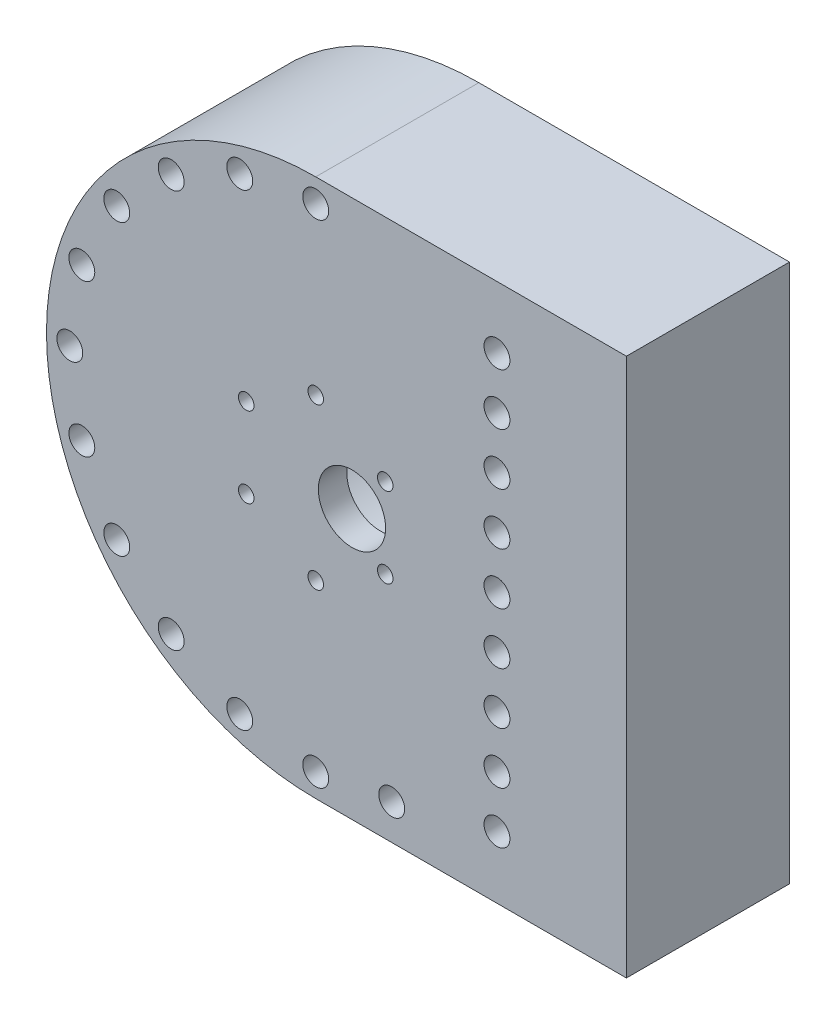
from build123d import *

# Parameters (mm, degrees)
CROQUIS1_R              = 18.725
SALIENTE_EXTRUIR1_DEPTH = 26
CROQUIS2_R              = 6.5
CROQUIS2_R_2            = 1.5
SALIENTE_EXTRUIR2_DEPTH = 5.5
CROQUIS3_R              = 2.5
CORTAR_EXTRUIR1_DEPTH   = 86.418089419
CROQUIS4_R              = 2.5
CORTAR_EXTRUIR2_DEPTH   = 20


with BuildPart() as part:
    # Croquis1 → Saliente-Extruir1 (new body)
    with BuildSketch(Plane.XY):
        with BuildLine():
            Line((0, 52), (60, 52))
            Line((60, 52), (60, -52))
            Line((60, -52), (0, -52))
            ThreePointArc((0, -52), (-52, 0), (0, 52))
        make_face()
        with Locations(Location((0, 0, 0), (0, 0, 180))):
            Circle(CROQUIS1_R, mode=Mode.SUBTRACT)
    extrude(amount=SALIENTE_EXTRUIR1_DEPTH)

    # Croquis2 → Saliente-Extruir2 (add)
    with BuildSketch(Plane.XY.offset(26)):
        with BuildLine():
            Line((0, -52), (60, -52))
            Line((60, -52), (60, 52))
            Line((60, 52), (0, 52))
            ThreePointArc((0, 52), (-52, 0), (0, -52))
        make_face()
        with Locations((7, 0)):
            Circle(CROQUIS2_R, mode=Mode.SUBTRACT)
        with Locations((13.423393759, -7.75)):
            Circle(CROQUIS2_R_2, mode=Mode.SUBTRACT)
        with Locations((13.423393759, 7.75)):
            Circle(CROQUIS2_R_2, mode=Mode.SUBTRACT)
        with Locations((0, 15.5)):
            Circle(CROQUIS2_R_2, mode=Mode.SUBTRACT)
        with Locations((0, -15.5)):
            Circle(CROQUIS2_R_2, mode=Mode.SUBTRACT)
        with Locations((-13.423393759, -7.75)):
            Circle(CROQUIS2_R_2, mode=Mode.SUBTRACT)
        with Locations((-13.423393759, 7.75)):
            Circle(CROQUIS2_R_2, mode=Mode.SUBTRACT)
    extrude(amount=SALIENTE_EXTRUIR2_DEPTH)

    # Croquis3 → Cortar-Extruir1 (cut, through all)
    with BuildSketch(Plane.XY.offset(31.5)):
        with Locations((35, 0)):
            Circle(CROQUIS3_R)
        with Locations((35, 20)):
            Circle(CROQUIS3_R)
        with Locations((35, 40)):
            Circle(CROQUIS3_R)
        with Locations(Location((35, -40, 0), (0, 0, 180))):
            Circle(CROQUIS3_R)
        with Locations(Location((35, -20, 0), (0, 0, 180))):
            Circle(CROQUIS3_R)
        with Locations((-14.678307233, 45.175184524)):
            Circle(CROQUIS3_R)
        with Locations((-38.428307233, 27.919799484)):
            Circle(CROQUIS3_R)
        with Locations((-47.5, 0)):
            Circle(CROQUIS3_R)
        with Locations((-38.428307233, -27.919799484)):
            Circle(CROQUIS3_R)
        with Locations((-14.678307233, -45.175184524)):
            Circle(CROQUIS3_R)
        with Locations((14.678307233, -45.175184524)):
            Circle(CROQUIS3_R)
    extrude(amount=-CORTAR_EXTRUIR1_DEPTH, mode=Mode.SUBTRACT)

    # Croquis4 → Cortar-Extruir2 (cut)
    with BuildSketch(Plane.XY.offset(31.5)):
        with Locations((0, 47.5)):
            Circle(CROQUIS4_R)
        with Locations((-27.919799484, 38.428307233)):
            Circle(CROQUIS4_R)
        with Locations((-45.175184524, 14.678307233)):
            Circle(CROQUIS4_R)
        with Locations((-45.175184524, -14.678307233)):
            Circle(CROQUIS4_R)
        with Locations((-27.919799484, -38.428307233)):
            Circle(CROQUIS4_R)
        with Locations((0, -47.5)):
            Circle(CROQUIS4_R)
        with Locations((35, 30)):
            Circle(CROQUIS4_R)
        with Locations((35, 10)):
            Circle(CROQUIS4_R)
        with Locations((35, -10)):
            Circle(CROQUIS4_R)
        with Locations((35, -30)):
            Circle(CROQUIS4_R)
    extrude(amount=-CORTAR_EXTRUIR2_DEPTH, mode=Mode.SUBTRACT)


solid = part.part
